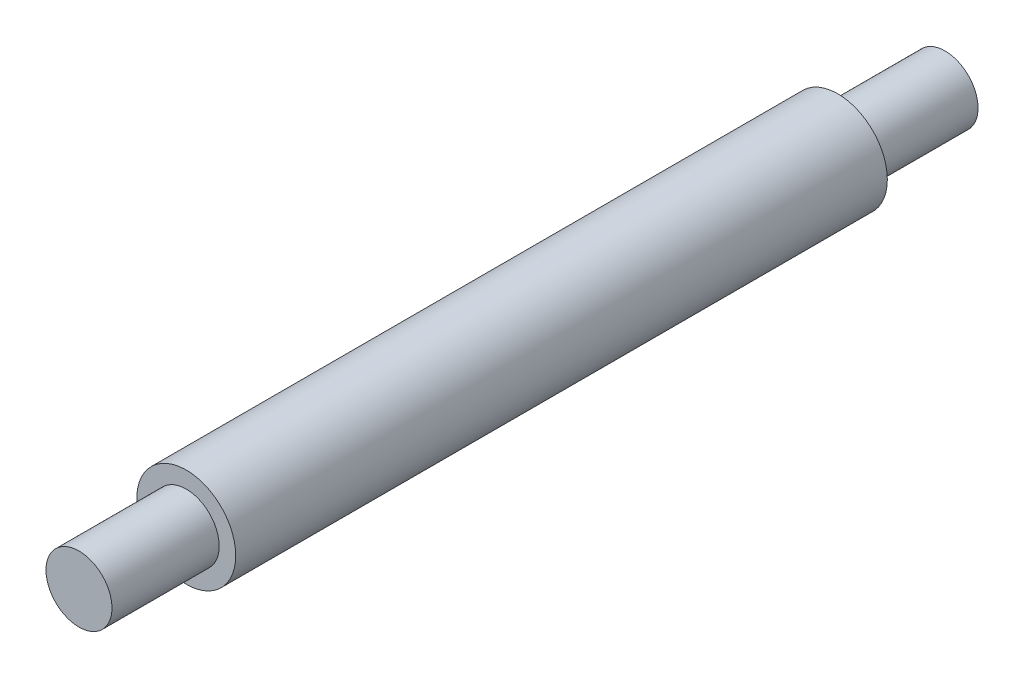
from build123d import *

# Parameters (mm, degrees)
SKETCH1_R           = 4
BOSS_EXTRUDE1_DEPTH = 13
SKETCH2_R           = 6
BOSS_EXTRUDE2_DEPTH = 79
SKETCH3_R           = 4
BOSS_EXTRUDE3_DEPTH = 13


with BuildPart() as part:
    # Sketch1 → Boss-Extrude1 (new body)
    with BuildSketch(Plane.XY):
        with Locations(Location((0, 0, 0), (0, 0, 180))):
            Circle(SKETCH1_R)
    extrude(amount=BOSS_EXTRUDE1_DEPTH)

    # Sketch2 → Boss-Extrude2 (add)
    with BuildSketch(Plane.XY.offset(13)):
        Circle(SKETCH2_R)
    extrude(amount=BOSS_EXTRUDE2_DEPTH)

    # Sketch3 → Boss-Extrude3 (add)
    with BuildSketch(Plane.XY.offset(92)):
        with Locations(Location((0, 0, 0), (0, 0, 180))):
            Circle(SKETCH3_R)
    extrude(amount=BOSS_EXTRUDE3_DEPTH)


solid = part.part
